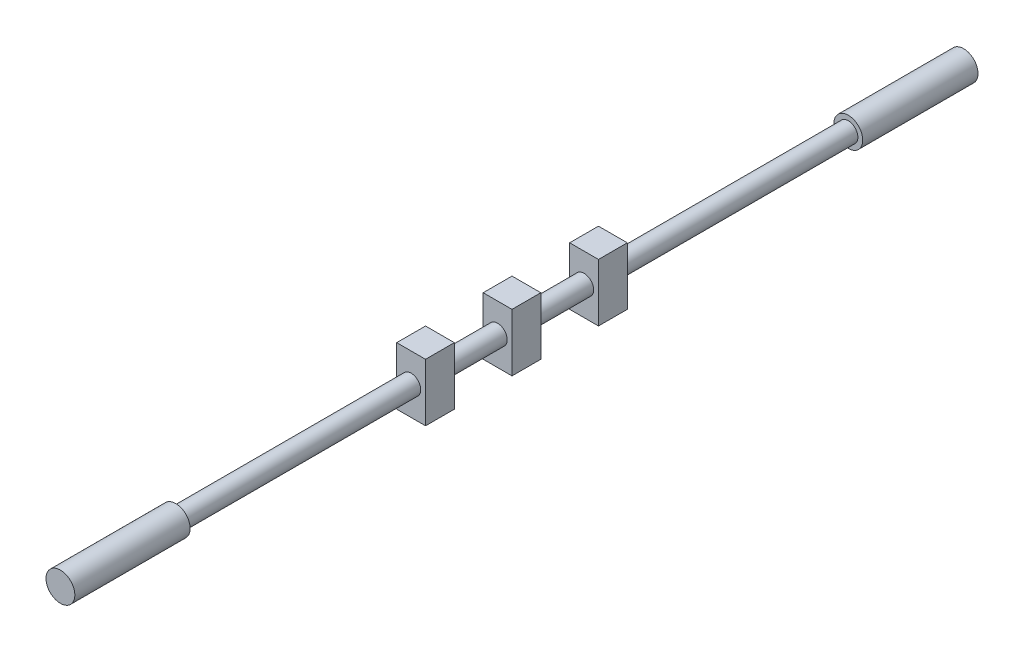
from build123d import *

# Parameters (mm, degrees)
SKETCH1_R           = 25.4
BOSS_EXTRUDE1_DEPTH = 1778
SKETCH2_R           = 38.1
BOSS_EXTRUDE2_DEPTH = 304.8
BOSS_EXTRUDE3_START = 304.8
SKETCH3_R           = 38.1
BOSS_EXTRUDE3_DEPTH = 304.8
SKETCH4_W           = 76.2
SKETCH4_H           = 76.2
BOSS_EXTRUDE4_DEPTH = 76.2


with BuildPart() as part:
    # Sketch1 → Boss-Extrude1 (new body)
    with BuildSketch(Plane.XY):
        Circle(SKETCH1_R)
    extrude(amount=BOSS_EXTRUDE1_DEPTH)

    # Sketch2 → Boss-Extrude2 (add)
    with BuildSketch(Plane.XY.offset(1778)):
        with Locations(Location((0, 0, 0), (0, 0, 180))):
            Circle(SKETCH2_R)
    extrude(amount=BOSS_EXTRUDE2_DEPTH)

    # Sketch3 → Boss-Extrude3 (add)
    with BuildSketch(Plane(origin=(0, 0, 0), x_dir=(-1, 0, 0), z_dir=(0, 0, -1)).offset(BOSS_EXTRUDE3_START)):
        Circle(SKETCH3_R)
    extrude(amount=-BOSS_EXTRUDE3_DEPTH)

    # Sketch4 → Boss-Extrude4 (add, symmetric)
    with BuildSketch(Plane(origin=(0, 0, 0), x_dir=(1, 0, 0), z_dir=(0, 1, 0))):
        with Locations((0, -889)):
            Rectangle(SKETCH4_W, SKETCH4_H)
        with Locations((0, -1117.6)):
            Rectangle(SKETCH4_W, SKETCH4_H)
        with Locations((0, -660.4)):
            Rectangle(SKETCH4_W, SKETCH4_H)
    extrude(amount=BOSS_EXTRUDE4_DEPTH, both=True)


solid = part.part
